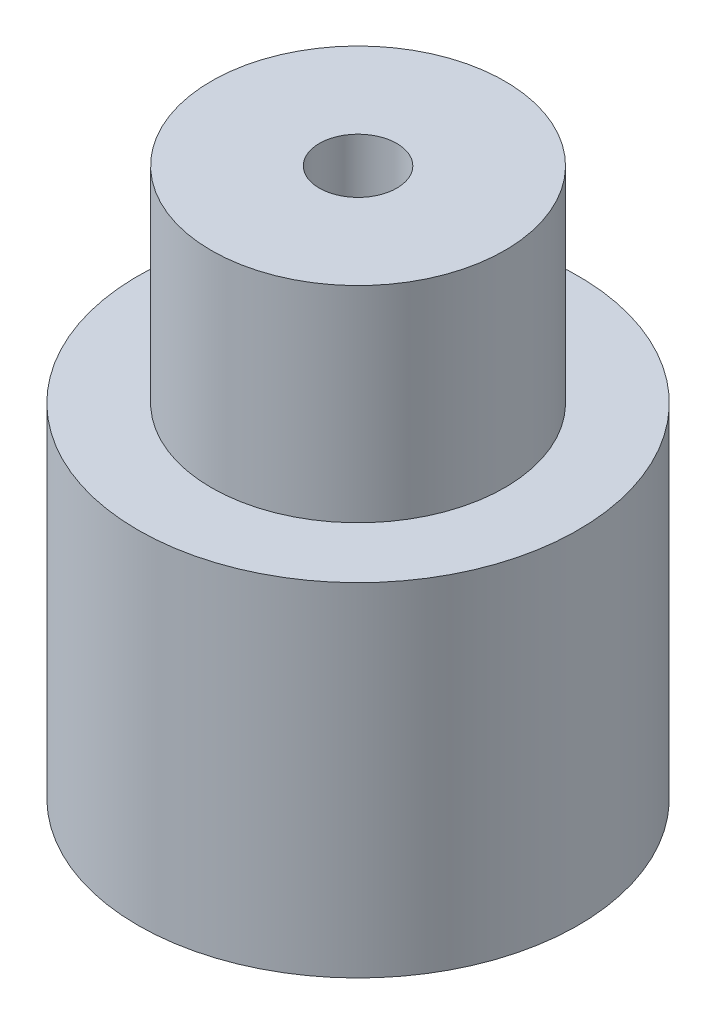
from build123d import *

# Parameters (mm, degrees)
SKETCH_1_R          = 9
EXTRUDE_1_DEPTH     = 14
SKETCH_2_R          = 6
EXTRUDE_2_DEPTH     = 8.4
CUT_EXTRUDE_1_REACH = 27.764
SKETCH_4_R          = 1.585


with BuildPart() as part:
    # 草图1 → 凸台-拉伸1 (new body)
    with BuildSketch(Plane(origin=(0, 0, 0), x_dir=(1, 0, 0), z_dir=(0, 1, 0))):
        with Locations(Location((0, 0, 0), (0, 0, 270))):
            Circle(SKETCH_1_R)
    extrude(amount=EXTRUDE_1_DEPTH)

    # 草图2 → 凸台-拉伸2 (add)
    with BuildSketch(Plane(origin=(0, 14, 0), x_dir=(1, 0, 0), z_dir=(0, 1, 0))):
        with Locations(Location((0, 0, 0), (0, 0, 270))):
            Circle(SKETCH_2_R)
    extrude(amount=EXTRUDE_2_DEPTH)

    # 草图4 → 切除-拉伸1 (cut, up to next)
    with BuildSketch(Plane(origin=(0, 22.4, 0), x_dir=(1, 0, 0), z_dir=(0, 1, 0)), mode=Mode.PRIVATE) as cut_extrude_1_sk1:
        with Locations(Location((0, 0, 0), (0, 0, 270))):
            Circle(SKETCH_4_R)
    cut_extrude_1_tool1 = extrude(cut_extrude_1_sk1.sketch, amount=-CUT_EXTRUDE_1_REACH, mode=Mode.PRIVATE) & part.part
    add(cut_extrude_1_tool1.solids().sort_by_distance((0, 22.4, 0))[0], mode=Mode.SUBTRACT)


solid = part.part
